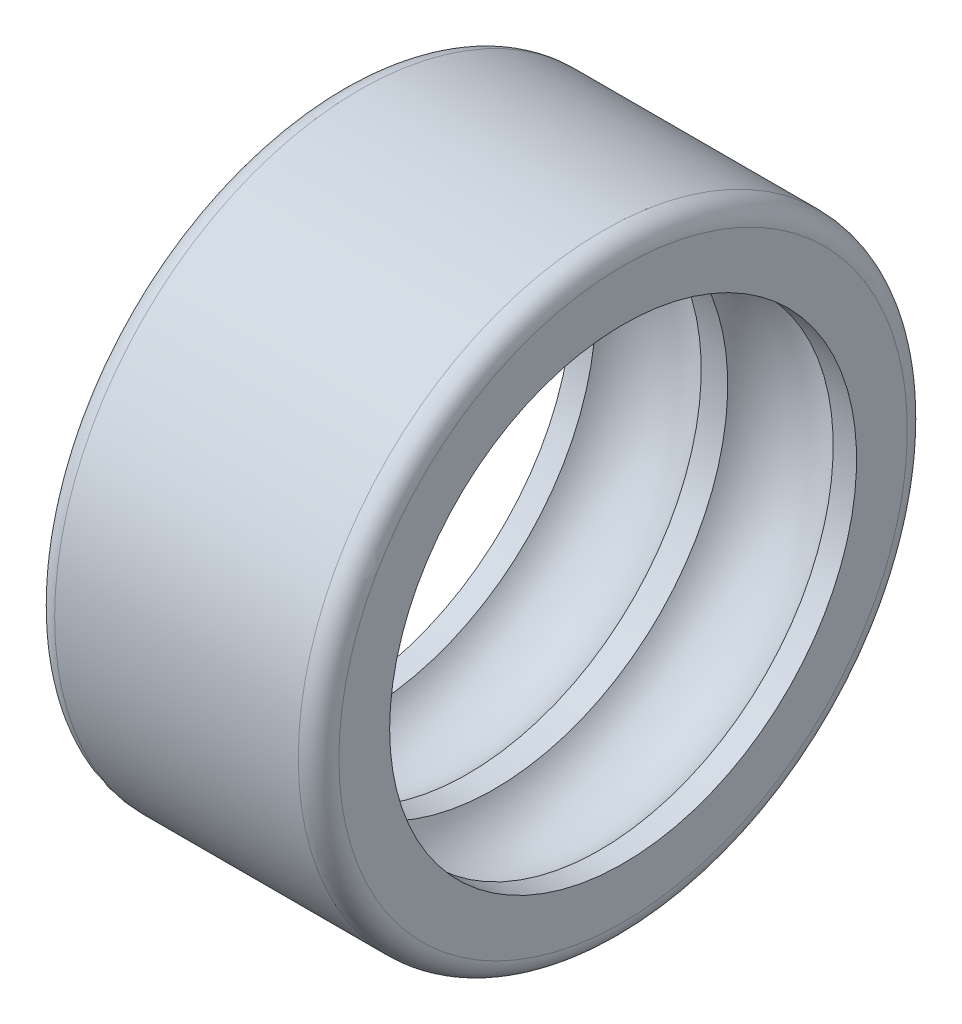
from build123d import *

# Parameters (mm, degrees)
CONG_1_R = 1


with BuildPart() as part:
    # Esquisse1 → Base-Révolution (revolve)
    with BuildSketch(Plane.XY, mode=Mode.PRIVATE) as base_r_volution_sk:
        with BuildLine():
            Line((0, 11.5), (0, 15))
            Line((0, 15), (14, 15))
            Line((14, 15), (14, 11.5))
            Line((14, 11.5), (12.848076211, 11.5))
            ThreePointArc((12.848076211, 11.5), (10.25, 13), (7.651923789, 11.5))
            Line((7.651923789, 11.5), (6.348076211, 11.5))
            ThreePointArc((6.348076211, 11.5), (3.75, 13), (1.151923789, 11.5))
            Line((1.151923789, 11.5), (0, 11.5))
        make_face()
    revolve(base_r_volution_sk.sketch.rotate(Axis((0, 0, 0), (1, 0, 0)), 90), axis=Axis((0, 0, 0), (1, 0, 0)))

    # Congé1
    cong_1_edges = [part.edges().sort_by_distance(p)[0] for p in [
        (0, 0, -15),
        (14, 0, -15),
    ]]
    fillet(cong_1_edges, radius=CONG_1_R)


solid = part.part
